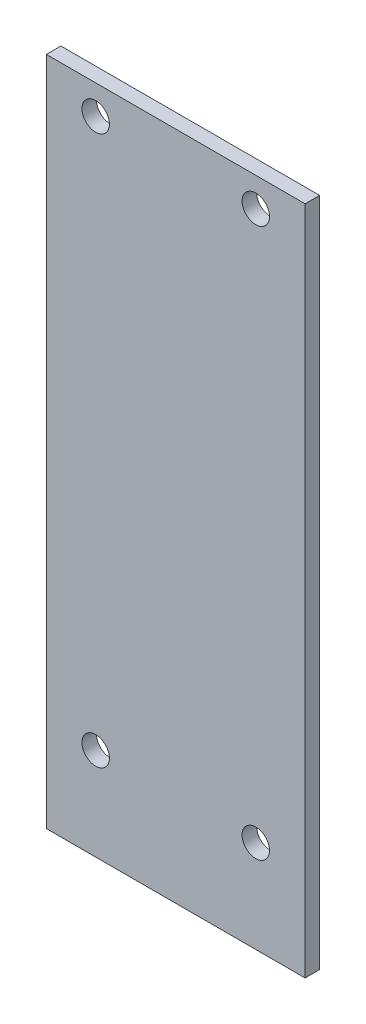
from build123d import *

# Parameters (mm, degrees)
SKETCH1_W           = 56.55
SKETCH1_H           = 146.55
BOSS_EXTRUDE1_DEPTH = 3.175
SKETCH2_R           = 3
CUT_EXTRUDE1_DEPTH  = 79.605228039


with BuildPart() as part:
    # Sketch1 → Boss-Extrude1 (new body)
    with BuildSketch(Plane.XY):
        Rectangle(SKETCH1_W, SKETCH1_H)
    extrude(amount=BOSS_EXTRUDE1_DEPTH)

    # Sketch2 → Cut-Extrude1 (cut, through all)
    with BuildSketch(Plane.XY.offset(3.175)):
        with Locations((17.5, -53.075)):
            Circle(SKETCH2_R)
        with Locations((-17.5, -53.075)):
            Circle(SKETCH2_R)
        with Locations((-17.5, 66.925)):
            Circle(SKETCH2_R)
        with Locations((17.5, 66.925)):
            Circle(SKETCH2_R)
    extrude(amount=-CUT_EXTRUDE1_DEPTH, mode=Mode.SUBTRACT)


solid = part.part
